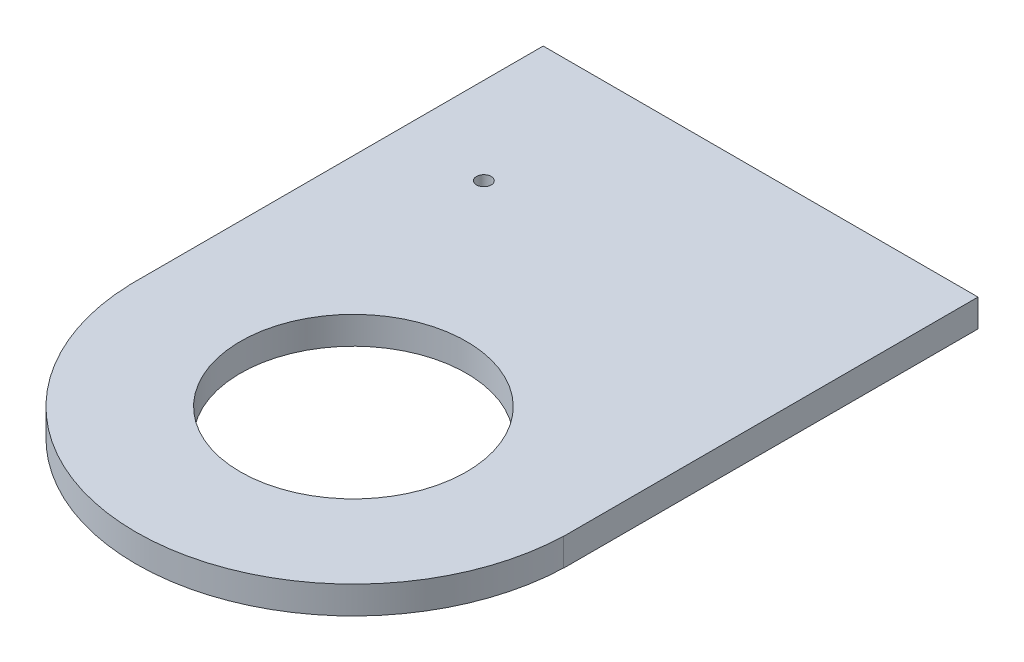
from build123d import *

# Parameters (mm, degrees)
PARED_START                = 29.75
SK_PARED_W                 = 100
SK_PARED_H                 = 95.3
PARED_DEPTH                = 6.35
CABEZA_START               = 29.75
SK_CABEZA_R                = 50
CABEZA_DEPTH               = 6.35
PASO_CUBO_J2_START         = 29.75
SK_PASO_CUBO_J2_R          = 26
PASO_CUBO_J2_DEPTH         = 6.35
PASANTE_M3_CINCHO_START    = 29.75
SK_PASANTE_M3_CINCHO_R     = 1.7
PASANTE_M3_CINCHO_DEPTH    = 6.35
SK_ROSCA_M3_DESDE_ABAJO_R  = 1.25
ROSCA_M3_DESDE_ABAJO_DEPTH = 9


with BuildPart() as part:
    # Sk_Pared → Pared (new body)
    with BuildSketch(Plane(origin=(0, 0, 0), x_dir=(1, 0, 0), z_dir=(0, 1, 0)).offset(PARED_START)):
        with Locations((0, -124)):
            Rectangle(SK_PARED_W, SK_PARED_H)
    extrude(amount=PARED_DEPTH)

    # Sk_Cabeza → Cabeza (add)
    with BuildSketch(Plane(origin=(0, 0, 0), x_dir=(1, 0, 0), z_dir=(0, 1, 0)).offset(CABEZA_START)):
        with Locations((0, -170)):
            Circle(SK_CABEZA_R)
    extrude(amount=CABEZA_DEPTH)

    # Sk_Paso_cubo_J2 → Paso_cubo_J2 (cut)
    with BuildSketch(Plane(origin=(0, 0, 0), x_dir=(1, 0, 0), z_dir=(0, 1, 0)).offset(PASO_CUBO_J2_START)):
        with Locations(Location((0, -170, 0), (0, 0, 270))):
            Circle(SK_PASO_CUBO_J2_R)
    extrude(amount=PASO_CUBO_J2_DEPTH, mode=Mode.SUBTRACT)

    # Sk_Pasante_M3_cincho → Pasante_M3_cincho (cut)
    with BuildSketch(Plane(origin=(0, 0, 0), x_dir=(1, 0, 0), z_dir=(0, 1, 0)).offset(PASANTE_M3_CINCHO_START)):
        with Locations(Location((-30, -110, 0), (0, 0, 270))):
            Circle(SK_PASANTE_M3_CINCHO_R)
    extrude(amount=PASANTE_M3_CINCHO_DEPTH, mode=Mode.SUBTRACT)

    # Sk_Rosca_M3_desde_abajo → Rosca_M3_desde_abajo (cut)
    with BuildSketch(Plane(origin=(0, 0, 76.35), x_dir=(-1, 0, 0), z_dir=(0, 0, -1))):
        with Locations((42, 32.9275)):
            Circle(SK_ROSCA_M3_DESDE_ABAJO_R)
        with Locations((20, 32.9275)):
            Circle(SK_ROSCA_M3_DESDE_ABAJO_R)
        with Locations((-20, 32.9275)):
            Circle(SK_ROSCA_M3_DESDE_ABAJO_R)
        with Locations((-42, 32.9275)):
            Circle(SK_ROSCA_M3_DESDE_ABAJO_R)
    extrude(amount=-ROSCA_M3_DESDE_ABAJO_DEPTH, mode=Mode.SUBTRACT)


solid = part.part
